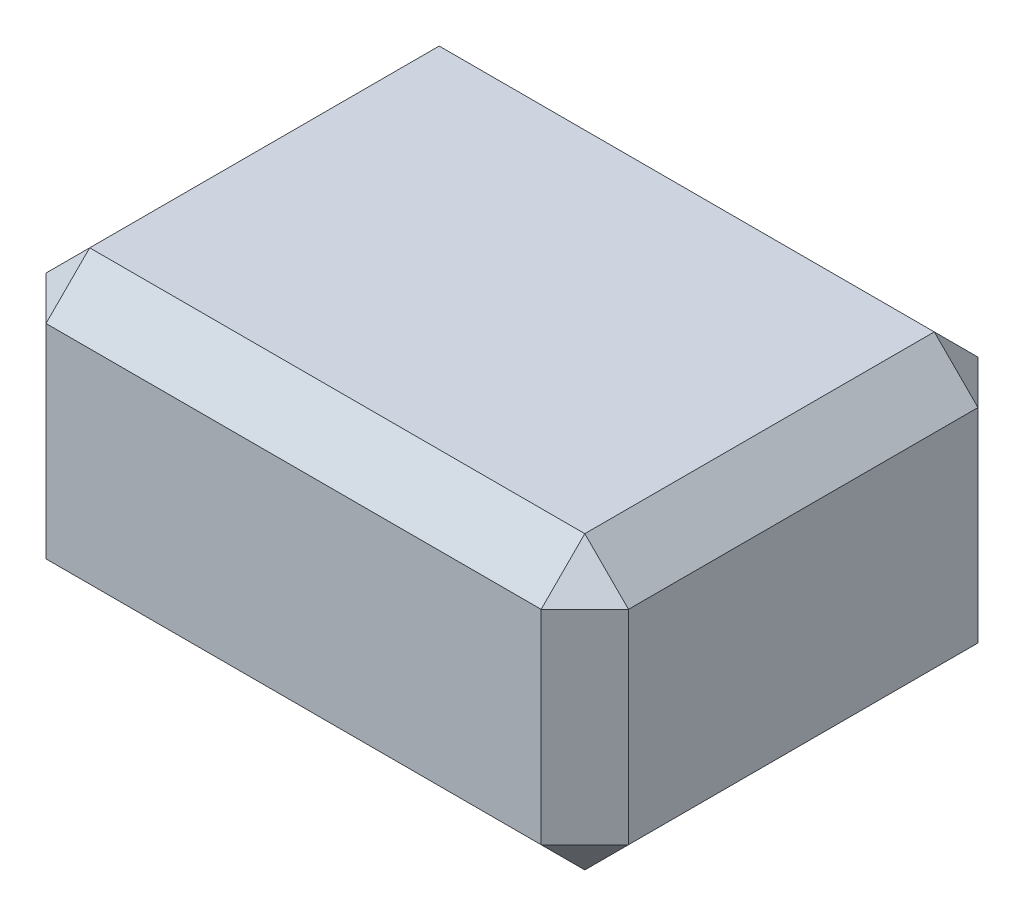
from build123d import *

# Parameters (mm, degrees)
SKETCH1_W           = 40
SKETCH1_H           = 30
BOSS_EXTRUDE1_DEPTH = 20
CHAMFER1_SIZE2      = 2.99999902
CHAMFER1_SIZE       = 3


with BuildPart() as part:
    # Sketch1 → Boss-Extrude1 (new body)
    with BuildSketch(Plane(origin=(0, 0, 0), x_dir=(1, 0, 0), z_dir=(0, 1, 0))):
        Rectangle(SKETCH1_W, SKETCH1_H)
    extrude(amount=BOSS_EXTRUDE1_DEPTH)

    # Chamfer1
    chamfer1_edges = [part.edges().sort_by_distance(p)[0] for p in [
        (20, 20, 0),
        (0, 20, -15),
        (-20, 20, 0),
        (0, 0, -15),
        (20, 0, 0),
        (0, 0, 15),
        (-20, 0, 0),
        (-20, 10, -15),
        (20, 10, -15),
        (20, 10, 15),
        (-20, 10, 15),
        (0, 20, 15),
    ]]
    chamfer(chamfer1_edges, length=CHAMFER1_SIZE, length2=CHAMFER1_SIZE2)


solid = part.part
